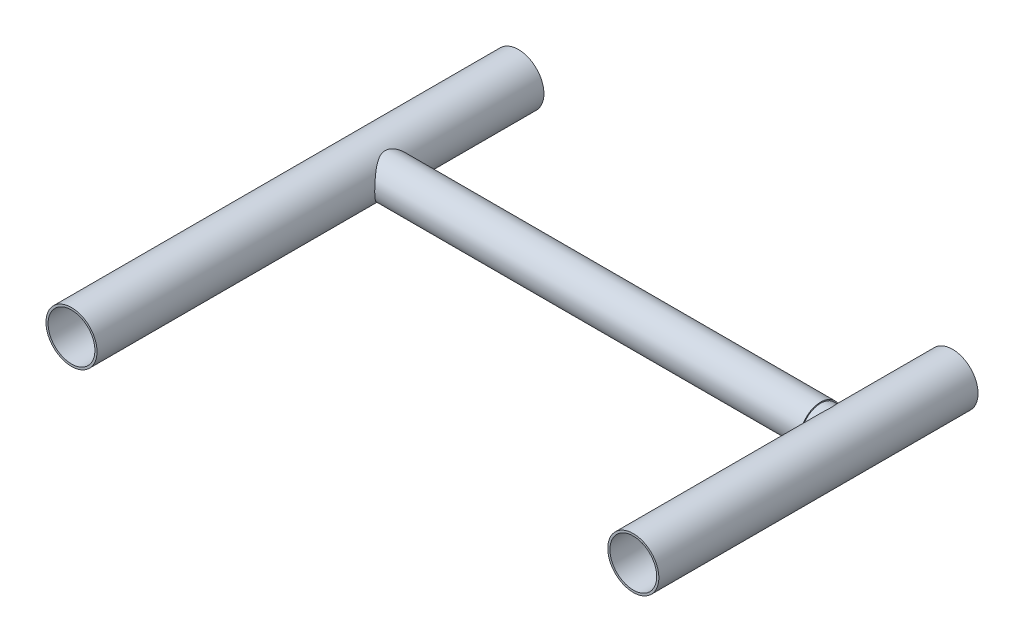
from build123d import *

# Parameters (mm, degrees)
SKETCH_1_R           = 12
SKETCH_1_R_2         = 11
EXTRUDE_1_DEPTH      = 210
SKETCH_2_R           = 9.5
CUT_EXTRUDE_1_DEPTH  = 12
EXTRUDE_2_DEPTH      = 200
EXTRUDE_2_DEPTH_BACK = 11
SKETCH_2_3_R         = 9.5
SKETCH_2_3_R_2       = 7.5
SKETCH_1_2_R         = 11
CUT_EXTRUDE_2_DEPTH  = 250
EXTRUDE_3_DEPTH      = 50
EXTRUDE_3_DEPTH_BACK = 100
SKETCH_5_R           = 12
SKETCH_5_R_2         = 11
CUT_EXTRUDE_START    = 12
SKETCH_6_R           = 9.5
CUT_EXTRUDE_3_DEPTH  = 12
SKETCH_8_R           = 9
SKETCH_8_R_2         = 8
EXTRUDE_4_DEPTH      = 12
SKETCH_9_R           = 10
CUT_EXTRUDE_4_DEPTH  = 97


with BuildPart() as part:
    # 草图1 → 凸台-拉伸1 (new body)
    with BuildSketch(Plane.XY):
        with Locations((12, 0)):
            Circle(SKETCH_1_R)
        with Locations((12, 0)):
            Circle(SKETCH_1_R_2, mode=Mode.SUBTRACT)
    extrude(amount=EXTRUDE_1_DEPTH)

    # 草图2 → 切除-拉伸1 (cut)
    with BuildSketch(Plane(origin=(24, 0, 0), x_dir=(0, 0, -1), z_dir=(1, 0, 0))):
        with Locations((-70, 0)):
            Circle(SKETCH_2_R)
    extrude(amount=-CUT_EXTRUDE_1_DEPTH, mode=Mode.SUBTRACT)

    # 草图2<3> → 凸台-拉伸2 (add, two sides: drawn at the far end of the back side and taken through both)
    with BuildSketch(Plane(origin=(24, 0, 0), x_dir=(0, 0, -1), z_dir=(1, 0, 0)).offset(-EXTRUDE_2_DEPTH_BACK)):
        with Locations((-70, 0)):
            Circle(SKETCH_2_3_R)
        with Locations((-70, 0)):
            Circle(SKETCH_2_3_R_2, mode=Mode.SUBTRACT)
    extrude(amount=EXTRUDE_2_DEPTH + EXTRUDE_2_DEPTH_BACK)

    # 草图1<2> → 切除-拉伸2 (cut)
    with BuildSketch(Plane.XY):
        with Locations((12, 0)):
            Circle(SKETCH_1_2_R)
    extrude(amount=CUT_EXTRUDE_2_DEPTH, mode=Mode.SUBTRACT)

    # 草图8 → 凸台-拉伸4 (add)
    with BuildSketch(Plane(origin=(224, 0, 0), x_dir=(0, 0, -1), z_dir=(1, 0, 0))):
        with Locations((-70, 0)):
            Circle(SKETCH_8_R)
        with Locations((-70, 0)):
            Circle(SKETCH_8_R_2, mode=Mode.SUBTRACT)
    extrude(amount=EXTRUDE_4_DEPTH)

    # 草图9 → 切除-拉伸4 (cut)
    with BuildSketch(Plane(origin=(0, 0, 20), x_dir=(-1, 0, 0), z_dir=(0, 0, -1))):
        with Locations((-236, 0)):
            Circle(SKETCH_9_R)
    extrude(amount=-CUT_EXTRUDE_4_DEPTH, mode=Mode.SUBTRACT)


with BuildPart() as body_2:
    # 草图5 → 凸台-拉伸3 (new, two sides: drawn at the far end of the back side and taken through both)
    with BuildSketch(Plane(origin=(0, 0, 70), x_dir=(-1, 0, 0), z_dir=(0, 0, -1)).offset(-EXTRUDE_3_DEPTH_BACK)):
        with Locations((-236, 0)):
            Circle(SKETCH_5_R)
        with Locations((-236, 0)):
            Circle(SKETCH_5_R_2, mode=Mode.SUBTRACT)
    extrude(amount=EXTRUDE_3_DEPTH + EXTRUDE_3_DEPTH_BACK)

    # 草图6 → 切除-拉伸3 (cut)
    with BuildSketch(Plane(origin=(224, 0, 0), x_dir=(0, 0, -1), z_dir=(1, 0, 0)).offset(CUT_EXTRUDE_START)):
        with Locations((-70, 0)):
            Circle(SKETCH_6_R)
    extrude(amount=-CUT_EXTRUDE_3_DEPTH, mode=Mode.SUBTRACT)


solid = Compound([part.part, body_2.part])
